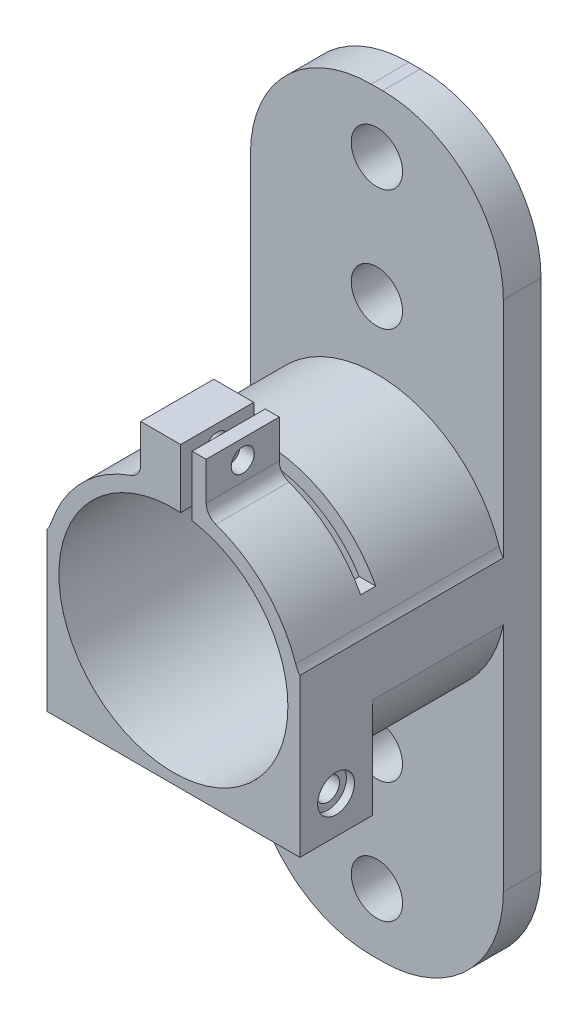
from build123d import *

# Parameters (mm, degrees)
BOSS_EXTRUDE1_DEPTH      = 55.499
SKETCH2_R                = 12.6492
CUT_EXTRUDE1_DEPTH       = 21.082
CUT_EXTRUDE2_START       = -47.498
CUT_EXTRUDE2_DEPTH       = 47.498
CUT_EXTRUDE3_DEPTH       = 64.719756461
CUT_EXTRUDE4_DEPTH       = 69.159299334
CUT_EXTRUDE5_DEPTH       = 69.159299334
FILLET1_R                = 4.9911
FILLET2_R                = 4.9911
SKETCH7_R                = 1.27
CUT_EXTRUDE6_DEPTH       = 4.826
CUT_EXTRUDE7_START       = -4.826
SKETCH8_R                = 1.27
CUT_EXTRUDE7_DEPTH       = 4.826
SKETCH9_R                = 1.27
CUT_EXTRUDE8_DEPTH       = 4.318
CUT_EXTRUDE9_START       = -4.318
SKETCH10_R               = 1.27
CUT_EXTRUDE9_DEPTH       = 4.318
SKETCH11_W               = 1.6764
SKETCH11_H               = 7.62
CUT_EXTRUDE10_DEPTH      = 69.159299334
BOSS_EXTRUDE2_DEPTH      = 8.0772
SKETCH13_W               = 1.27
SKETCH13_H               = 8.69888745
CUT_EXTRUDE11_DEPTH      = 8.0772
FILLET3_R                = 1.5875
SKETCH14_R               = 1.27
CUT_EXTRUDE12_DEPTH      = 67.881616192
SKETCH15_R               = 2.032
CUT_EXTRUDE13_DEPTH      = 0.889
CUT_EXTRUDE14_START      = -0.889
SKETCH16_R               = 2.032
CUT_EXTRUDE14_DEPTH      = 0.889
SCALE1_SCALE             = 0.6
CUT_EXTRUDE15_DEPTH      = 51.873928307
CUT_EXTRUDE15_DEPTH_BACK = 51.873928307
SKETCH17_W               = 22.594181605
SKETCH17_H               = 22.052877317
SKETCH18_W               = 16.764
SKETCH18_H               = 50
BOSS_EXTRUDE3_DEPTH      = 2.5
FILLET4_R                = 8
M3_CLEARANCE_HOLE1_D     = 3.4
M3_CLEARANCE_HOLE1_DEPTH = 2.5


with BuildPart() as part:
    # Sketch1 → Boss-Extrude1 (new body)
    with BuildSketch(Plane.XY):
        with BuildLine():
            Line((-13.97, 0), (13.97, 0))
            Line((13.97, 0), (13.97, 17.415057792))
            ThreePointArc((13.97, 17.415057792), (13.699370909, 17.834675567), (13.502160632, 18.293399109))
            ThreePointArc((13.502160632, 18.293399109), (0, 28.0162), (-13.502160632, 18.293399109))
            ThreePointArc((-13.502160632, 18.293399109), (-13.699370909, 17.834675567), (-13.97, 17.415057792))
            Line((-13.97, 17.415057792), (-13.97, 0))
        make_face()
    extrude(amount=-BOSS_EXTRUDE1_DEPTH)

    # Sketch2 → Cut-Extrude1 (cut)
    with BuildSketch(Plane.XY):
        with Locations((0, 13.7795)):
            Circle(SKETCH2_R)
    extrude(amount=-CUT_EXTRUDE1_DEPTH, mode=Mode.SUBTRACT)

    # Sketch3 → Cut-Extrude2 (cut)
    with BuildSketch(Plane(origin=(0, 0, -55.499), x_dir=(-1, 0, 0), z_dir=(0, 0, -1)).offset(CUT_EXTRUDE2_START)):
        with BuildLine():
            Line((-13.97, 0), (-13.97, 11.036741008))
            ThreePointArc((-13.97, 11.036741008), (-10.365518606, 4.020419566), (-3.578967259, 0))
            Line((-3.578967259, 0), (-13.97, 0))
        make_face()
        with BuildLine():
            Line((13.97, 0), (3.578967259, 0))
            ThreePointArc((3.578967259, 0), (10.365518606, 4.020419566), (13.97, 11.036741008))
            Line((13.97, 11.036741008), (13.97, 0))
        make_face()
    extrude(amount=CUT_EXTRUDE2_DEPTH, mode=Mode.SUBTRACT)

    # Sketch4 → Cut-Extrude3 (cut, through all)
    with BuildSketch(Plane(origin=(0, 0, 0), x_dir=(1, 0, 0), z_dir=(0, 1, 0))):
        with BuildLine():
            Line((-10.033, 46.5201), (-10.033, 26.4795))
            ThreePointArc((-10.033, 26.4795), (-8.861280678, 23.650719322), (-6.0325, 22.479))
            Line((-6.0325, 22.479), (6.0325, 22.479))
            ThreePointArc((6.0325, 22.479), (8.861280678, 23.650719322), (10.033, 26.4795))
            Line((10.033, 26.4795), (10.033, 46.5201))
            ThreePointArc((10.033, 46.5201), (8.861280678, 49.348880678), (6.0325, 50.5206))
            Line((6.0325, 50.5206), (-6.0325, 50.5206))
            ThreePointArc((-6.0325, 50.5206), (-8.861280678, 49.348880678), (-10.033, 46.5201))
        make_face()
    extrude(amount=CUT_EXTRUDE3_DEPTH, mode=Mode.SUBTRACT)

    # Sketch5 → Cut-Extrude4 (cut, through all)
    with BuildSketch(Plane(origin=(13.97, 0, 0), x_dir=(0, 0, -1), z_dir=(1, 0, 0))):
        with BuildLine():
            Line((22.479, 30.552887158), (22.479, 23.126200001))
            ThreePointArc((22.479, 23.126200001), (23.650572876, 20.297772876), (26.479000001, 19.1262))
            Line((26.479000001, 19.1262), (58.380075255, 19.1262))
            Line((58.380075255, 19.1262), (58.380075255, 30.552887158))
            Line((58.380075255, 30.552887158), (22.479, 30.552887158))
        make_face()
    extrude(amount=-CUT_EXTRUDE4_DEPTH, mode=Mode.SUBTRACT)

    # Sketch6 → Cut-Extrude5 (cut, through all)
    with BuildSketch(Plane(origin=(13.97, 0, 0), x_dir=(0, 0, -1), z_dir=(1, 0, 0))):
        with BuildLine():
            Line((26.479000001, 5.7404), (41.275, 5.7404))
            Line((41.275, 5.7404), (56.850797395, 10.801283358))
            Line((56.850797395, 10.801283358), (56.850797395, -1.681383137))
            Line((56.850797395, -1.681383137), (22.479, -1.681383137))
            Line((22.479, -1.681383137), (22.479, 1.740399999))
            ThreePointArc((22.479, 1.740399999), (23.650572876, 4.568827124), (26.479000001, 5.7404))
        make_face()
    extrude(amount=-CUT_EXTRUDE5_DEPTH, mode=Mode.SUBTRACT)

    # Fillet1
    fillet1_edges = [part.edges().sort_by_distance(p)[0] for p in [
        (0, 19.1262, -55.499),
    ]]
    fillet(fillet1_edges, radius=FILLET1_R)

    # Fillet2
    fillet2_edges = [part.edges().sort_by_distance(p)[0] for p in [
        (0, 10.362057759, -55.499),
    ]]
    fillet(fillet2_edges, radius=FILLET2_R)

    # Sketch7 → Cut-Extrude6 (cut)
    with BuildSketch(Plane(origin=(13.97, 0, 0), x_dir=(0, 0, -1), z_dir=(1, 0, 0))):
        with Locations(Location((50.5079, 14.061702085, 0), (0, 0, 90))):
            Circle(SKETCH7_R)
    extrude(amount=-CUT_EXTRUDE6_DEPTH, mode=Mode.SUBTRACT)

    # Sketch8 → Cut-Extrude7 (cut)
    with BuildSketch(Plane.ZY.offset(13.97).offset(CUT_EXTRUDE7_START)):
        with Locations(Location((-50.5079, 14.061702085, 0), (0, 0, 90))):
            Circle(SKETCH8_R)
    extrude(amount=CUT_EXTRUDE7_DEPTH, mode=Mode.SUBTRACT)

    # Sketch9 → Cut-Extrude8 (cut)
    with BuildSketch(Plane(origin=(13.97, 0, 0), x_dir=(0, 0, -1), z_dir=(1, 0, 0))):
        with Locations(Location((4.0005, 4.1148, 0), (0, 0, 90))):
            Circle(SKETCH9_R)
    extrude(amount=-CUT_EXTRUDE8_DEPTH, mode=Mode.SUBTRACT)

    # Sketch10 → Cut-Extrude9 (cut)
    with BuildSketch(Plane.ZY.offset(13.97).offset(CUT_EXTRUDE9_START)):
        with Locations(Location((-4.0005, 4.1148, 0), (0, 0, 90))):
            Circle(SKETCH10_R)
    extrude(amount=CUT_EXTRUDE9_DEPTH, mode=Mode.SUBTRACT)

    # Sketch11 → Cut-Extrude10 (cut, through all)
    with BuildSketch(Plane.ZY.offset(13.97)):
        with Locations((-8.9154, 24.2062)):
            Rectangle(SKETCH11_W, SKETCH11_H)
    extrude(amount=-CUT_EXTRUDE10_DEPTH, mode=Mode.SUBTRACT)

    # Sketch12 → Boss-Extrude2 (add)
    with BuildSketch(Plane.XY):
        with BuildLine():
            Line((-3.6195, 32.9184), (3.6195, 32.9184))
            Line((3.6195, 32.9184), (3.6195, 27.548408695))
            ThreePointArc((3.6195, 27.548408695), (0, 28.0162), (-3.6195, 27.548408695))
            Line((-3.6195, 27.548408695), (-3.6195, 32.9184))
        make_face()
    extrude(amount=-BOSS_EXTRUDE2_DEPTH)

    # Sketch13 → Cut-Extrude11 (cut)
    with BuildSketch(Plane.XY):
        with Locations((1.4351, 29.199787514)):
            Rectangle(SKETCH13_W, SKETCH13_H)
    extrude(amount=-CUT_EXTRUDE11_DEPTH, mode=Mode.SUBTRACT)

    # Fillet3
    fillet3_edges = [part.edges().sort_by_distance(p)[0] for p in [
        (3.6195, 27.548408695, -4.0386),
        (-3.6195, 27.548408695, -4.0386),
    ]]
    fillet(fillet3_edges, radius=FILLET3_R)

    # Sketch14 → Cut-Extrude12 (cut, through all)
    with BuildSketch(Plane(origin=(3.6195, 0, 0), x_dir=(0, 0, -1), z_dir=(1, 0, 0))):
        with Locations(Location((4.0386, 30.820436744, 0), (0, 0, 90))):
            Circle(SKETCH14_R)
    extrude(amount=-CUT_EXTRUDE12_DEPTH, mode=Mode.SUBTRACT)

    # Sketch15 → Cut-Extrude13 (cut)
    with BuildSketch(Plane(origin=(13.97, 0, 0), x_dir=(0, 0, -1), z_dir=(1, 0, 0))):
        with Locations(Location((4.0005, 4.1148, 0), (0, 0, 90))):
            Circle(SKETCH15_R)
        with Locations(Location((50.5079, 14.061702085, 0), (0, 0, 90))):
            Circle(SKETCH15_R)
    extrude(amount=-CUT_EXTRUDE13_DEPTH, mode=Mode.SUBTRACT)

    # Sketch16 → Cut-Extrude14 (cut)
    with BuildSketch(Plane.ZY.offset(13.97).offset(CUT_EXTRUDE14_START)):
        with Locations(Location((-50.5079, 14.061702085, 0), (0, 0, 90))):
            Circle(SKETCH16_R)
        with Locations(Location((-4.0005, 4.1148, 0), (0, 0, 90))):
            Circle(SKETCH16_R)
    extrude(amount=CUT_EXTRUDE14_DEPTH, mode=Mode.SUBTRACT)


with BuildPart() as part_1:
    # Scale1: scaled about (-0.010832485, 13.272964488, -25.431393294)
    add(part.part.scale(SCALE1_SCALE).moved(Location((-0.004332994, 5.309185795, -10.172557318))))

    # Sketch17 → Cut-Extrude15 (cut, two sides: drawn at the far end of the back side and taken through both)
    with BuildSketch(Plane(origin=(0, 0, 0), x_dir=(1, 0, 0), z_dir=(0, 1, 0)).offset(-CUT_EXTRUDE15_DEPTH_BACK)):
        with Locations((1.099382363, 34.686357372)):
            Rectangle(SKETCH17_W, SKETCH17_H)
    extrude(amount=CUT_EXTRUDE15_DEPTH + CUT_EXTRUDE15_DEPTH_BACK, mode=Mode.SUBTRACT)

    # Sketch18 → Boss-Extrude3 (add)
    with BuildSketch(Plane(origin=(0, 0, -23.659918713), x_dir=(-1, 0, 0), z_dir=(0, 0, -1))):
        with Locations((0.004315992, 13.576876814)):
            Rectangle(SKETCH18_W, SKETCH18_H)
    extrude(amount=BOSS_EXTRUDE3_DEPTH)

    # Fillet4
    fillet4_edges = [part_1.edges().sort_by_distance(p)[0] for p in [
        (8.377684008, 38.576876814, -24.909918713),
        (8.377684008, -11.423123186, -24.909918713),
        (-8.386315992, -11.423123186, -24.909918713),
        (-8.386315992, 38.576876814, -24.909918713),
    ]]
    fillet(fillet4_edges, radius=FILLET4_R)

    # M3 Clearance Hole1
    with Locations(Plane.XY.offset(-23.659918713)):
        with Locations((-0.004315992, 26.576876814), (-0.004315992, -7.423123186), (-0.004315992, 0.576876814), (-0.004315992, 34.576876814)):
            Hole(M3_CLEARANCE_HOLE1_D / 2, depth=M3_CLEARANCE_HOLE1_DEPTH)


solid = part_1.part
